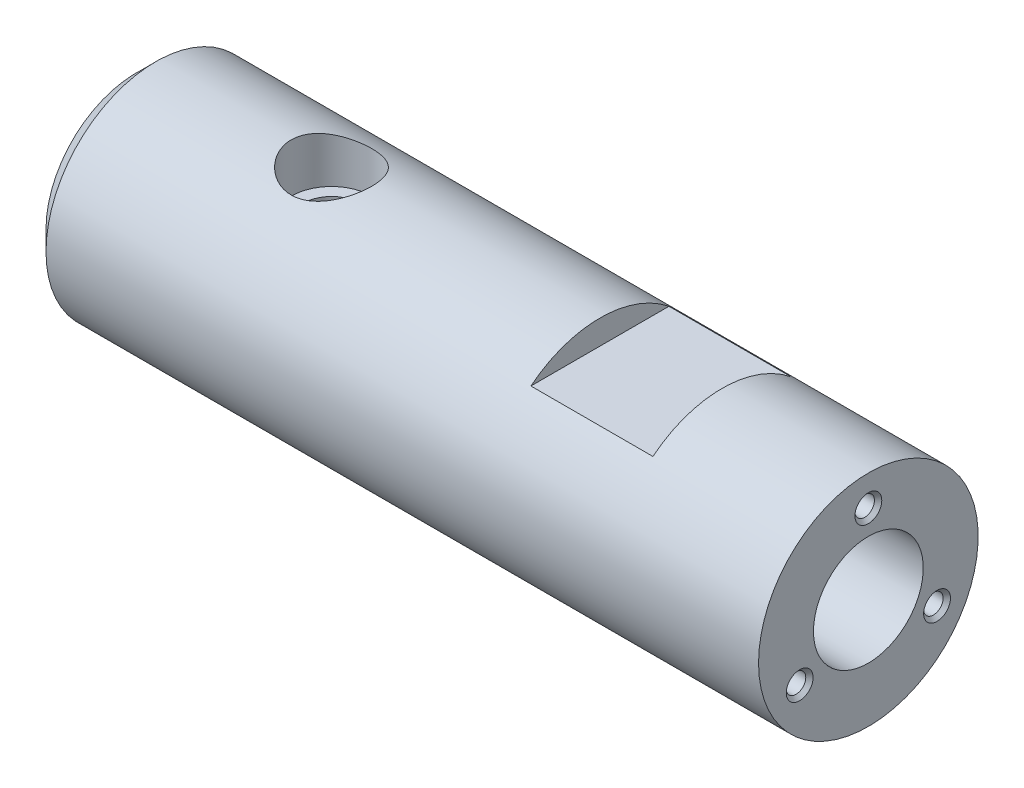
from build123d import *

# Parameters (mm, degrees)
SKETCH_3_W               = 10
SKETCH_3_H               = 2
CUT_EXTRUDE_1_DEPTH      = 46.803930098
PATTERN_CIRCULAR_1_COUNT = 2
PATTERN_CIRCULAR_2_COUNT = 3


with BuildPart() as part:
    # Эскиз1 → Повернуть1 (revolve)
    with BuildSketch(Plane.XY, mode=Mode.PRIVATE) as revolve_1_sk:
        Polygon((-16, 2.55), (-16, 4.75), (-14.6, 4.75), (-14.6, 6.75), (-16, 6.75), (-16, 7.4), (-14.4, 9), (44, 9), (44, 4.5), (-13, 4.5), (-13, 2.55), align=None)
    revolve(revolve_1_sk.sketch.rotate(Axis((-16, 0, 0), (1, 0, 0)), 90), axis=Axis((-16, 0, 0), (1, 0, 0)))

    # Эскиз2 → Вырез-Повернуть1 (revolve, cut)
    with BuildSketch(Plane.XY, mode=Mode.PRIVATE) as cut_revolve_1_sk:
        Polygon((0, 0), (0, 9), (3.3, 9), (3.3, 5), (2.3, 5), (2.3, 0), align=None)
    revolve(cut_revolve_1_sk.sketch.rotate(Axis((0, 0, 0), (0, 1, 0)), 90), axis=Axis((0, 0, 0), (0, 1, 0)), mode=Mode.SUBTRACT)

    # Эскиз3 → Вырез-Вытянуть1 (cut, symmetric)
    with BuildSketch(Plane.XY):
        with Locations((27, 8)):
            Rectangle(SKETCH_3_W, SKETCH_3_H)
    cut_extrude_1 = extrude(amount=CUT_EXTRUDE_1_DEPTH, both=True, mode=Mode.SUBTRACT)

    # Эскиз5 → Отверстие обработанное метчиком M21 (revolve, cut)
    with BuildSketch(Plane(origin=(44, 6.5, 0), x_dir=(0, 0, -1), z_dir=(0, 1, 0))):
        Polygon((0, 0), (0, 8.480688495), (0.8, 8), (0.8, 0.3), (1.1, 0), align=None)
    hole_wizard_m21 = revolve(axis=Axis((50.35, 6.5, 0), (-1, 0, 0)), mode=Mode.SUBTRACT)

    # Круговой массив1: Вырез-Вытянуть1 ×2 about axis
    pattern_circular_1_axis = Axis((-41.040855915, 0, 0), (1, 0, 0))
    for i in range(1, PATTERN_CIRCULAR_1_COUNT):
        add(cut_extrude_1.rotate(pattern_circular_1_axis, i * 360 / PATTERN_CIRCULAR_1_COUNT), mode=Mode.SUBTRACT)

    # Круговой массив2: Отверстие обработанное метчиком M21 ×3 about axis
    pattern_circular_2_axis = Axis((0, 0, 0), (1, 0, 0))
    for i in range(1, PATTERN_CIRCULAR_2_COUNT):
        add(hole_wizard_m21.rotate(pattern_circular_2_axis, i * 360 / PATTERN_CIRCULAR_2_COUNT), mode=Mode.SUBTRACT)


solid = part.part
